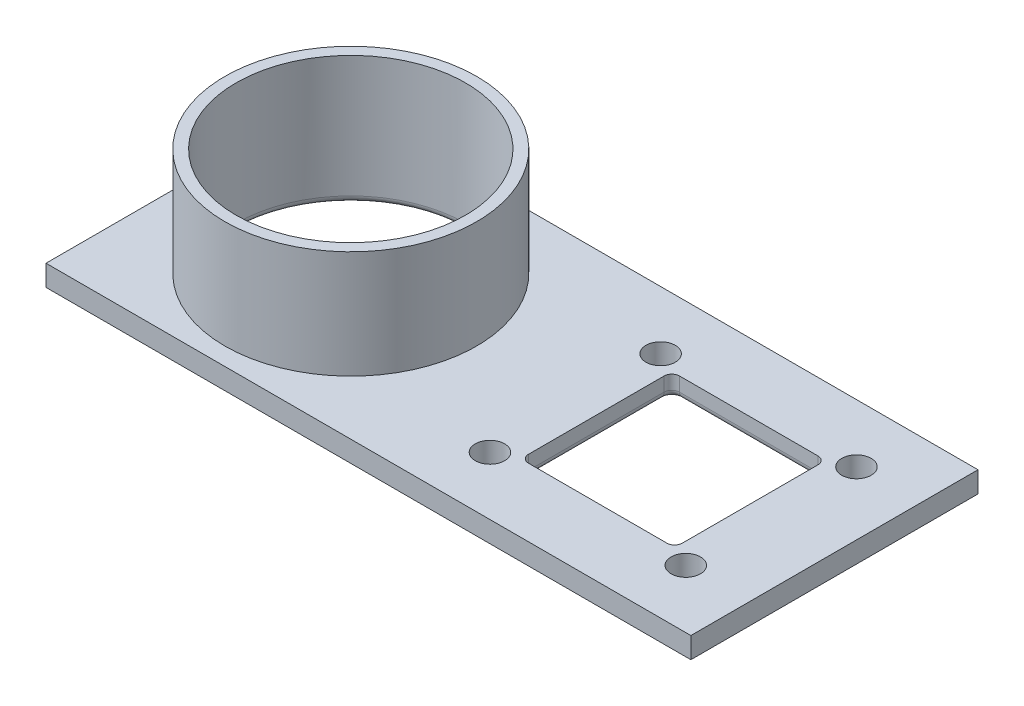
from build123d import *

# Parameters (mm, degrees)
CROQUIS1_W              = 46.097746062
CROQUIS1_H              = 20.525775368
CROQUIS1_R              = 1.05
SALIENTE_EXTRUIR1_DEPTH = 1.5
CROQUIS4_W              = 11
CROQUIS4_H              = 10.8
CORTAR_EXTRUIR1_DEPTH   = 1.5
REDONDEO1_R             = 0.55
CROQUIS7_R              = 9
SALIENTE_EXTRUIR3_DEPTH = 7.7
CROQUIS8_R              = 8.2
CORTAR_EXTRUIR3_DEPTH   = 27.855491275
REDONDEO2_R             = 0.5
REDONDEO3_R             = 0.5


with BuildPart() as part:
    # Croquis1 → Saliente-Extruir1 (new body)
    with BuildSketch(Plane(origin=(0, 0, 0), x_dir=(1, 0, 0), z_dir=(0, 1, 0))):
        Rectangle(CROQUIS1_W, CROQUIS1_H)
        with Locations(Location((4.524436516, 6.1, 0), (0, 0, 270))):
            Circle(CROQUIS1_R, mode=Mode.SUBTRACT)
        with Locations(Location((18.524436516, 6.1, 0), (0, 0, 270))):
            Circle(CROQUIS1_R, mode=Mode.SUBTRACT)
        with Locations(Location((18.524436516, -6.1, 0), (0, 0, 90))):
            Circle(CROQUIS1_R, mode=Mode.SUBTRACT)
        with Locations(Location((4.524436516, -6.1, 0), (0, 0, 90))):
            Circle(CROQUIS1_R, mode=Mode.SUBTRACT)
    extrude(amount=SALIENTE_EXTRUIR1_DEPTH)

    # Croquis4 → Cortar-Extruir1 (cut)
    with BuildSketch(Plane(origin=(0, 1.5, 0), x_dir=(1, 0, 0), z_dir=(0, 1, 0))):
        with Locations((11.524436516, 0)):
            Rectangle(CROQUIS4_W, CROQUIS4_H)
    extrude(amount=-CORTAR_EXTRUIR1_DEPTH, mode=Mode.SUBTRACT)

    # Redondeo1
    redondeo1_edges = [part.edges().sort_by_distance(p)[0] for p in [
        (6.024436516, 0.75, -5.4),
        (17.024436516, 0.75, -5.4),
        (17.024436516, 0.75, 5.4),
        (6.024436516, 0.75, 5.4),
    ]]
    fillet(redondeo1_edges, radius=REDONDEO1_R)

    # Croquis7 → Saliente-Extruir3 (add)
    with BuildSketch(Plane(origin=(0, 1.5, 0), x_dir=(1, 0, 0), z_dir=(0, 1, 0))):
        with Locations(Location((-11.524436516, 0, 0), (0, 0, 90))):
            Circle(CROQUIS7_R)
    extrude(amount=SALIENTE_EXTRUIR3_DEPTH)

    # Croquis8 → Cortar-Extruir3 (cut, through all)
    with BuildSketch(Plane(origin=(0, 9.2, 0), x_dir=(1, 0, 0), z_dir=(0, 1, 0))):
        with Locations(Location((-11.524436516, 0, 0), (0, 0, 270))):
            Circle(CROQUIS8_R)
    extrude(amount=-CORTAR_EXTRUIR3_DEPTH, mode=Mode.SUBTRACT)

    # Redondeo2
    redondeo2_edges = [part.edges().sort_by_distance(p)[0] for p in [
        (17.024436516, 0, 0),
        (11.524436516, 0, 5.4),
        (6.024436516, 0, 0),
        (11.524436516, 0, -5.4),
        (16.863345245, 0, 5.23890873),
        (6.185527786, 0, 5.23890873),
        (16.863345245, 0, -5.23890873),
        (6.185527786, 0, -5.23890873),
    ]]
    fillet(redondeo2_edges, radius=REDONDEO2_R)

    # Redondeo3
    redondeo3_edges = [part.edges().sort_by_distance(p)[0] for p in [
        (-11.524436516, 0, -8.2),
    ]]
    fillet(redondeo3_edges, radius=REDONDEO3_R)


solid = part.part
